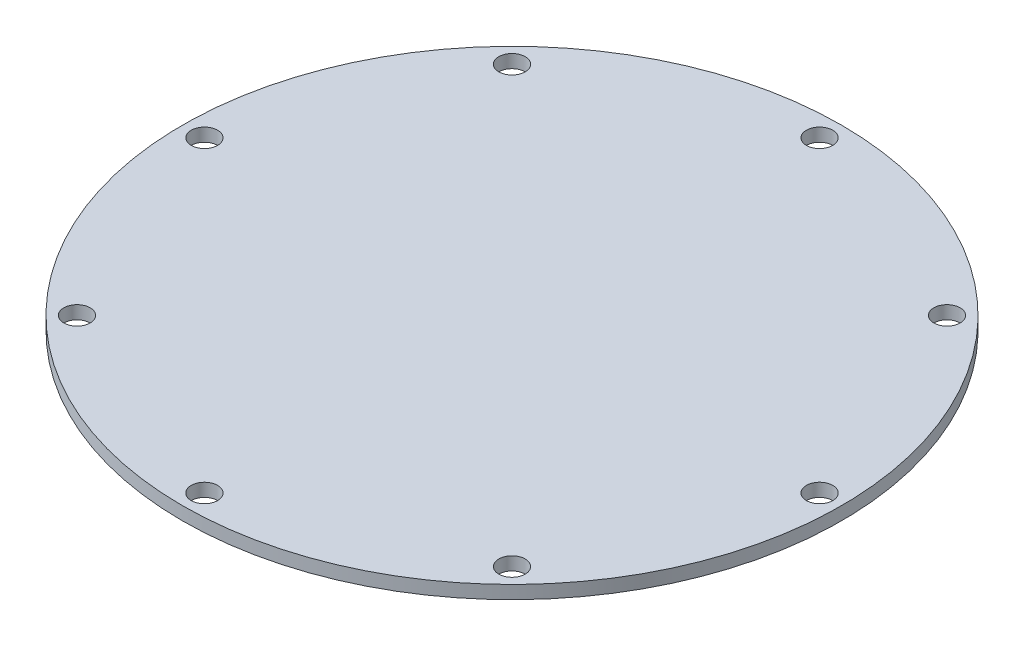
from build123d import *

# Parameters (mm, degrees)
SKETCH_1_R          = 75
EXTRUDE_1_DEPTH     = 3
SKETCH_2_R          = 3
CUT_EXTRUDE_1_DEPTH = 3


with BuildPart() as part:
    # Эскиз1 → Бобышка-Вытянуть1 (new body)
    with BuildSketch(Plane(origin=(0, 0, 0), x_dir=(1, 0, 0), z_dir=(0, 1, 0))):
        with Locations(Location((0, 0, 0), (0, 0, 270))):
            Circle(SKETCH_1_R)
    extrude(amount=EXTRUDE_1_DEPTH)

    # Эскиз2 → Вырез-Вытянуть1 (cut)
    with BuildSketch(Plane(origin=(0, 3, 0), x_dir=(1, 0, 0), z_dir=(0, 1, 0))):
        with Locations(Location((-70, 0, 0), (0, 0, 270))):
            Circle(SKETCH_2_R)
        with Locations(Location((70, 0, 0), (0, 0, 90))):
            Circle(SKETCH_2_R)
        with Locations(Location((0, -70, 0), (0, 0, 270))):
            Circle(SKETCH_2_R)
        with Locations(Location((0, 70, 0), (0, 0, 90))):
            Circle(SKETCH_2_R)
        with Locations(Location((-49.497474683, -49.497474683, 0), (0, 0, 270))):
            Circle(SKETCH_2_R)
        with Locations(Location((-49.497474683, 49.497474683, 0), (0, 0, 90))):
            Circle(SKETCH_2_R)
        with Locations(Location((49.497474683, -49.497474683, 0), (0, 0, 270))):
            Circle(SKETCH_2_R)
        with Locations(Location((49.497474683, 49.497474683, 0), (0, 0, 90))):
            Circle(SKETCH_2_R)
    extrude(amount=-CUT_EXTRUDE_1_DEPTH, mode=Mode.SUBTRACT)


solid = part.part
